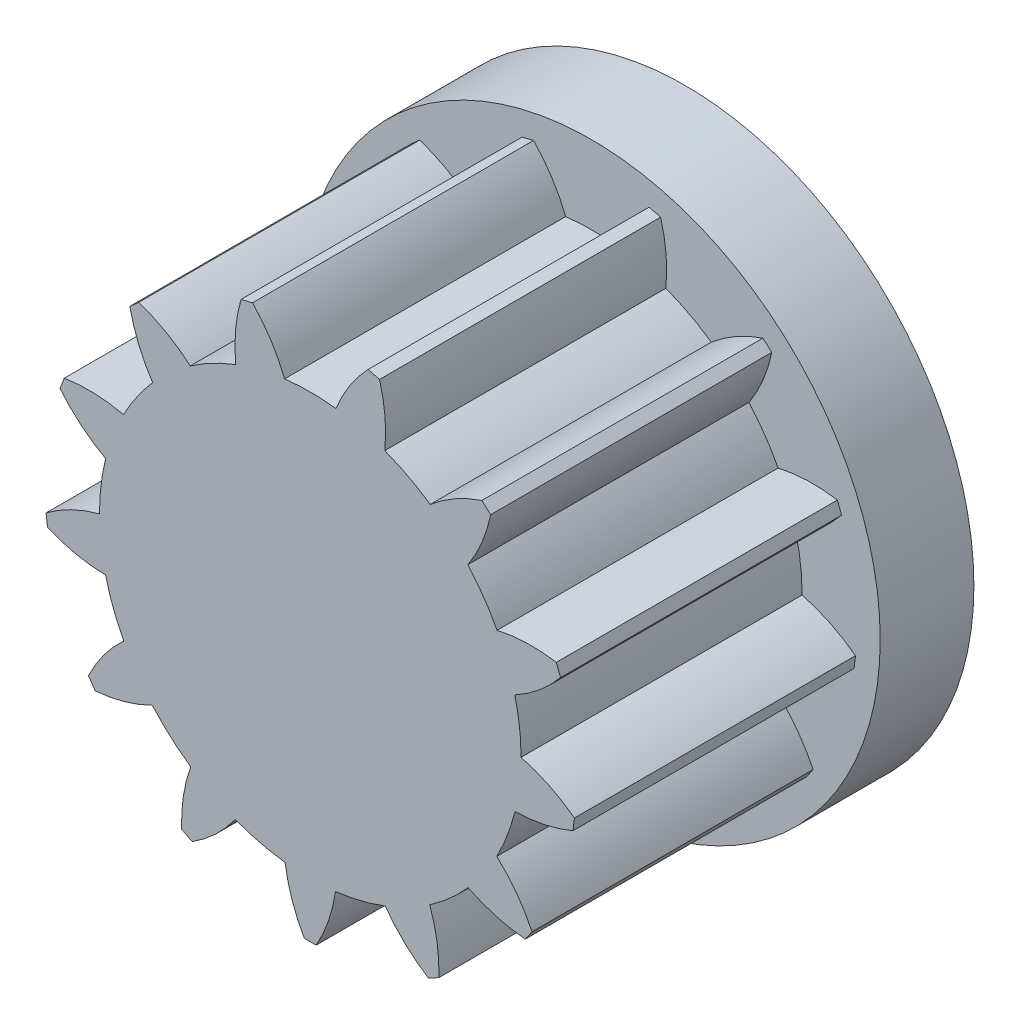
from build123d import *

# Parameters (mm, degrees)
SKETCH1_R           = 9.25
BOSS_EXTRUDE1_DEPTH = 3
BOSS_EXTRUDE2_DEPTH = 9


with BuildPart() as part:
    # Sketch1 → Boss-Extrude1 (new body)
    with BuildSketch(Plane.XY):
        Circle(SKETCH1_R)
    extrude(amount=BOSS_EXTRUDE1_DEPTH)

    # Sketch2 → Boss-Extrude2 (add)
    with BuildSketch(Plane.XY.offset(3)):
        with BuildLine():
            Line((2.218704647, 8.205324472), (1.849752862, 8.296289192))
            ThreePointArc((1.849752862, 8.296289192), (1.25913347, 7.547573069), (0.822693575, 6.699677252))
            ThreePointArc((0.822693575, 6.699677252), (0.000453114, 6.749999985), (-0.821794095, 6.699787643))
            ThreePointArc((-0.821794095, 6.699787643), (-1.258120151, 7.547742047), (-1.848639018, 8.296537457))
            Line((-1.848639018, 8.296537457), (-2.217603012, 8.205622273))
            ThreePointArc((-2.217603012, 8.205622273), (-2.39262478, 7.268192553), (-2.385036281, 6.31459436))
            ThreePointArc((-2.385036281, 6.31459436), (-3.136480191, 5.977038732), (-3.841209099, 5.550460581))
            ThreePointArc((-3.841209099, 5.550460581), (-4.621620694, 6.098516089), (-5.492481762, 6.487113696))
            Line((-5.492481762, 6.487113696), (-5.776932761, 6.235146179))
            ThreePointArc((-5.776932761, 6.235146179), (-5.496261527, 5.323756714), (-5.046383068, 4.482914))
            ThreePointArc((-5.046383068, 4.482914), (-5.554883684, 3.834809938), (-5.98064939, 3.12958989))
            ThreePointArc((-5.98064939, 3.12958989), (-6.926363634, 3.252193589), (-7.878063126, 3.191570364))
            Line((-7.878063126, 3.191570364), (-8.012836833, 2.836273238))
            ThreePointArc((-8.012836833, 2.836273238), (-7.340770995, 2.159712371), (-6.551664309, 1.624252067))
            ThreePointArc((-6.551664309, 1.624252067), (-6.700730268, 0.814072401), (-6.74999498, -0.008232129))
            ThreePointArc((-6.74999498, -0.008232129), (-7.644360136, -0.339167268), (-8.458875168, -0.835123275))
            Line((-8.458875168, -0.835123275), (-8.413096553, -1.212355721))
            ThreePointArc((-8.413096553, -1.212355721), (-7.503598294, -1.49909605), (-6.556038214, -1.60650644))
            ThreePointArc((-6.556038214, -1.60650644), (-6.3115203, -2.393159313), (-5.972998067, -3.144168267))
            ThreePointArc((-5.972998067, -3.144168267), (-6.611125856, -3.852828992), (-7.101860851, -4.670500236))
            Line((-7.101860851, -4.670500236), (-6.886017241, -4.983248595))
            ThreePointArc((-6.886017241, -4.983248595), (-5.947441652, -4.814479631), (-5.058502772, -4.469233682))
            ThreePointArc((-5.058502772, -4.469233682), (-4.476417094, -5.052147068), (-3.827659279, -5.559813346))
            ThreePointArc((-3.827659279, -5.559813346), (-4.063362315, -6.483854026), (-4.117895799, -7.435921879))
            Line((-4.117895799, -7.435921879), (-3.781434364, -7.612539271))
            ThreePointArc((-3.781434364, -7.612539271), (-3.028797802, -7.02692395), (-2.402125307, -6.308113348))
            ThreePointArc((-2.402125307, -6.308113348), (-1.615820678, -6.553748816), (-0.805449879, -6.70177219))
            ThreePointArc((-0.805449879, -6.70177219), (-0.584731436, -7.629506241), (-0.190570445, -8.497863432))
            Line((-0.190570445, -8.497863432), (0.189429554, -8.49788894))
            ThreePointArc((0.189429554, -8.49788894), (0.583707123, -7.629584676), (0.804550118, -6.701880267))
            ThreePointArc((0.804550118, -6.701880267), (1.614940783, -6.55396569), (2.401278382, -6.308435791))
            ThreePointArc((2.401278382, -6.308435791), (3.027854368, -7.027330521), (3.7804123, -7.613046883))
            Line((3.7804123, -7.613046883), (4.116897444, -7.436474665))
            ThreePointArc((4.116897444, -7.436474665), (4.062491781, -6.484399498), (3.826912806, -5.560327183))
            ThreePointArc((3.826912806, -5.560327183), (4.475738772, -5.052748009), (5.057902704, -4.469912777))
            ThreePointArc((5.057902704, -4.469912777), (5.946795225, -4.815278068), (6.885348147, -4.98417304))
            Line((6.885348147, -4.98417304), (7.101233744, -4.671453662))
            ThreePointArc((7.101233744, -4.671453662), (6.610608531, -3.853716541), (5.972575889, -3.14497015))
            ThreePointArc((5.972575889, -3.14497015), (6.311198947, -2.394006651), (6.555822471, -1.607386614))
            ThreePointArc((6.555822471, -1.607386614), (7.503396964, -1.50010344), (8.412933711, -1.21348522))
            Line((8.412933711, -1.21348522), (8.458762972, -0.836258923))
            ThreePointArc((8.458762972, -0.836258923), (7.644314532, -0.340193567), (6.749993814, -0.009138357))
            ThreePointArc((6.749993814, -0.009138357), (6.700839502, 0.813172779), (6.551882316, 1.623372451))
            ThreePointArc((6.551882316, 1.623372451), (7.341060883, 2.158726808), (8.013217548, 2.83519744))
            Line((8.013217548, 2.83519744), (7.878491542, 3.190512657))
            ThreePointArc((7.878491542, 3.190512657), (6.926800198, 3.251263653), (5.981069502, 3.128786923))
            ThreePointArc((5.981069502, 3.128786923), (5.555398481, 3.834064126), (5.046984881, 4.482236452))
            ThreePointArc((5.046984881, 4.482236452), (5.496976224, 5.32301876), (5.777769815, 6.234370535))
            Line((5.777769815, 6.234370535), (5.493352647, 6.486376238))
            ThreePointArc((5.493352647, 6.486376238), (4.622439416, 6.097895553), (3.841954247, 5.549944825))
            ThreePointArc((3.841954247, 5.549944825), (3.137282617, 5.976617587), (2.385884033, 6.314274098))
            ThreePointArc((2.385884033, 6.314274098), (2.393600558, 7.267871263), (2.218704647, 8.205324472))
        make_face()
    extrude(amount=BOSS_EXTRUDE2_DEPTH)


solid = part.part
